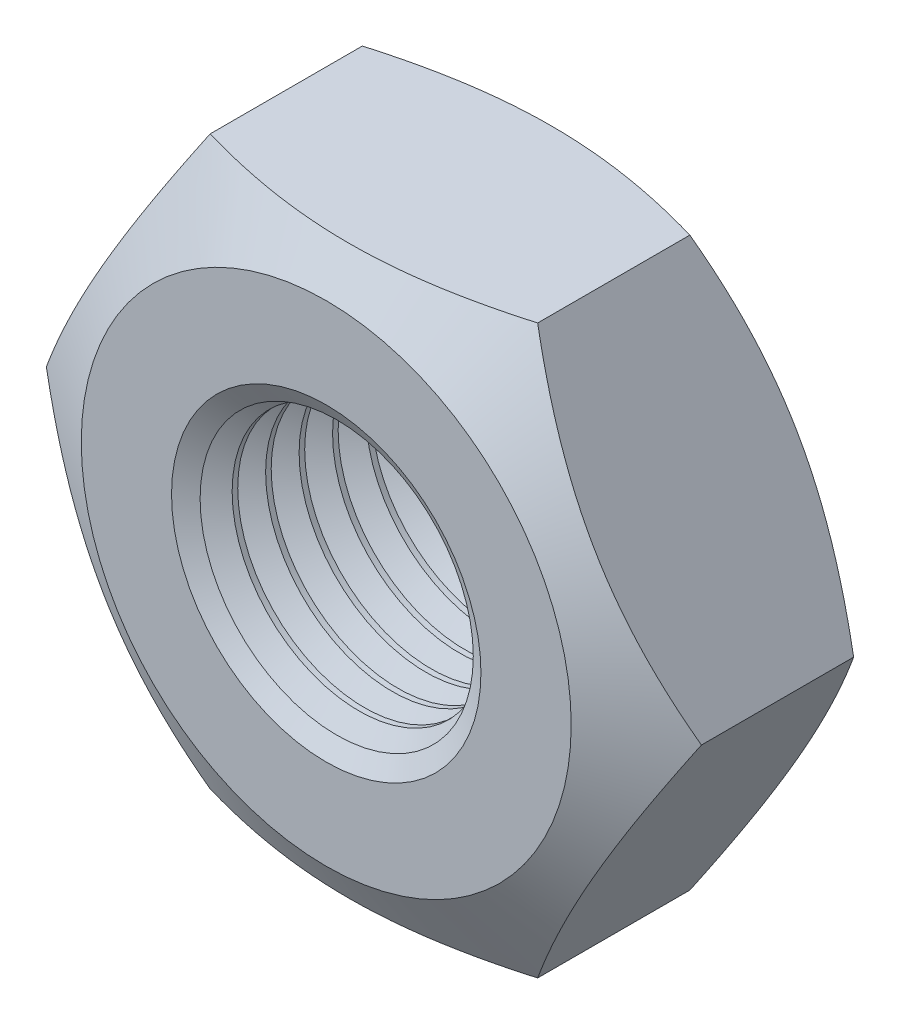
from build123d import *
from OCP.BRepFilletAPI import BRepFilletAPI_MakeChamfer

# Parameters (mm, degrees)
SKETCH1_R        = 1.2295
BASENUT_DEPTH    = 2.4
ENDCHAMFER_SIZE  = 0.2705
ENDCHAMFER_SIZE2 = 0.156173248
LPATTERN10_COUNT = 7
LPATTERN10_PITCH = 0.3246


with BuildPart() as part:
    # Sketch1 → BaseNut (new body)
    with BuildSketch(Plane.XY):
        Polygon((3.175426481, 0), (1.58771324, 2.75), (-1.58771324, 2.75), (-3.175426481, 0), (-1.58771324, -2.75), (1.58771324, -2.75), align=None)
        Circle(SKETCH1_R, mode=Mode.SUBTRACT)
    extrude(amount=-BASENUT_DEPTH)

    # Sketch2 → Double-Chamfer (revolve, cut)
    with BuildSketch(Plane(origin=(0, 0, 0), x_dir=(1, 0, 0), z_dir=(0, 1, 0))):
        Polygon((-3.175426481, 2.4), (-2.375, 2.4), (-3.175426481, 1.937873556), align=None)
        Polygon((-3.175426481, 0.462126444), (-3.175426481, 0), (-2.375, 0), align=None)
    revolve(axis=Axis((0, 0, -3.375940562), (0, 0, 1)), mode=Mode.SUBTRACT)

    # EndChamfer: one chamfer whose edges measure the first distance from different faces: ONE call of the kernel's chamfer builder (chamfer() names one face for all edges)
    endchamfer_edges_1 = [part.edges().sort_by_distance(p)[0] for p in [
        (-1.2295, 0, -2.4),
    ]]
    endchamfer_side_1 = [part.faces().sort_by_distance(p)[0] for p in [
        (-1.2295, 0, -1.2),
    ]]
    endchamfer_edges_2 = [part.edges().sort_by_distance(p)[0] for p in [
        (-1.2295, 0, 0),
    ]]
    endchamfer_side_2 = [part.faces().sort_by_distance(p)[0] for p in [
        (2.307824856, 0, 0),
    ]]
    endchamfer = BRepFilletAPI_MakeChamfer(part.part.solid().wrapped)
    for e in endchamfer_edges_1:
        endchamfer.Add(ENDCHAMFER_SIZE, ENDCHAMFER_SIZE2, e.wrapped, endchamfer_side_1[0].wrapped)  # the first distance lies on this face
    for e in endchamfer_edges_2:
        endchamfer.Add(ENDCHAMFER_SIZE, ENDCHAMFER_SIZE2, e.wrapped, endchamfer_side_2[0].wrapped)  # the first distance lies on this face
    add(Compound.cast(endchamfer.Shape()), mode=Mode.REPLACE)

    # Sketch3 → Cut-Revolve10 (revolve, cut)
    with BuildSketch(Plane(origin=(0, 0, 0), x_dir=(1, 0, 0), z_dir=(0, 1, 0)), mode=Mode.PRIVATE) as cut_revolve10_sk:
        Polygon((-1.463759872, 2.1295), (-1.2295, 1.99425), (-0.959, 1.99425), (-0.959, 2.26475), (-1.2295, 2.26475), align=None)
    cut_revolve10 = revolve(cut_revolve10_sk.sketch.rotate(Axis((0, 0, -7.438254559), (0, 0, -1)), 180), axis=Axis((0, 0, -7.438254559), (0, 0, -1)), mode=Mode.SUBTRACT)

    # LPattern10: Cut-Revolve10 ×7
    with Locations(*[(0, 0, i * LPATTERN10_PITCH) for i in range(1, LPATTERN10_COUNT)]):
        add(cut_revolve10, mode=Mode.SUBTRACT)


solid = part.part
